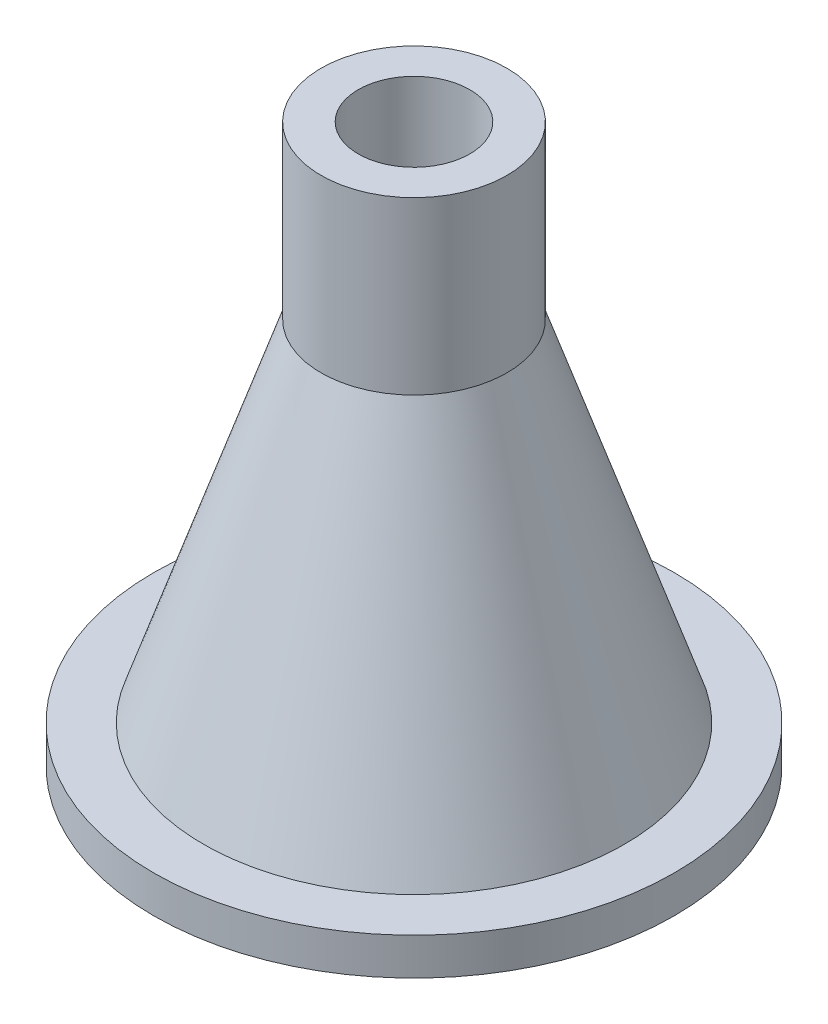
from build123d import *


with BuildPart() as part:
    # Sketch1 → Revolve2 (revolve)
    with BuildSketch(Plane.XY, mode=Mode.PRIVATE) as revolve2_sk:
        Polygon((75, 750), (75, 520), (250, 0), (350, 0), (350, 50), (283.173076923, 50), (125, 520), (125, 750), align=None)
    revolve(revolve2_sk.sketch.rotate(Axis((0, 0, 0), (0, 1, 0)), 90), axis=Axis((0, 0, 0), (0, 1, 0)))


solid = part.part
